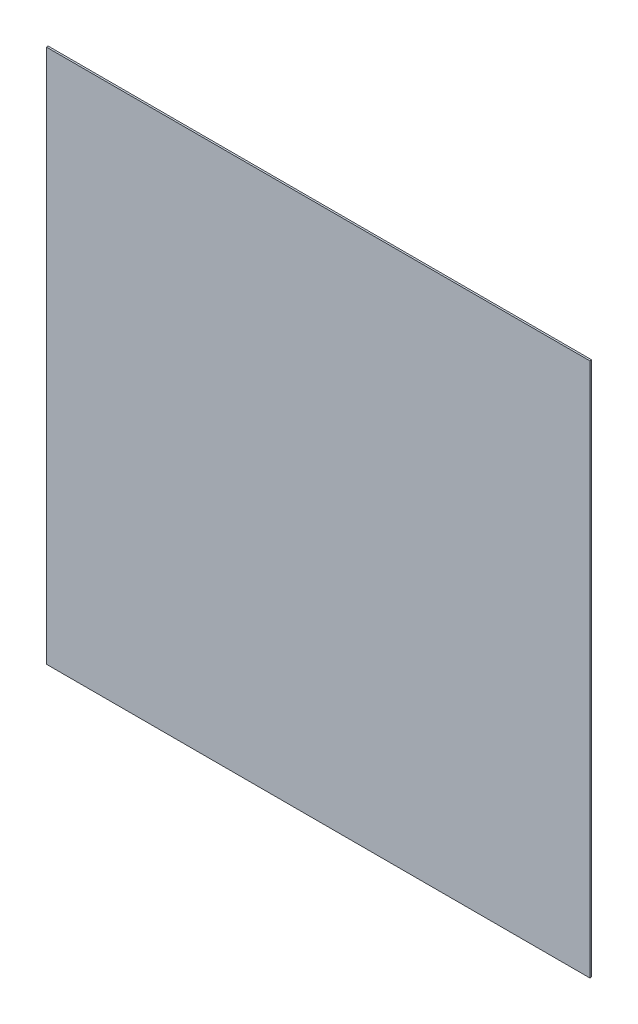
from build123d import *

# Parameters (mm, degrees)
SKETCH_1_W      = 600
SKETCH_1_H      = 590
EXTRUDE_1_DEPTH = 2


with BuildPart() as part:
    # Эскиз1 → Бобышка-Вытянуть1 (new body)
    with BuildSketch(Plane.XY):
        with Locations((300, 295)):
            Rectangle(SKETCH_1_W, SKETCH_1_H)
    extrude(amount=EXTRUDE_1_DEPTH)


solid = part.part
